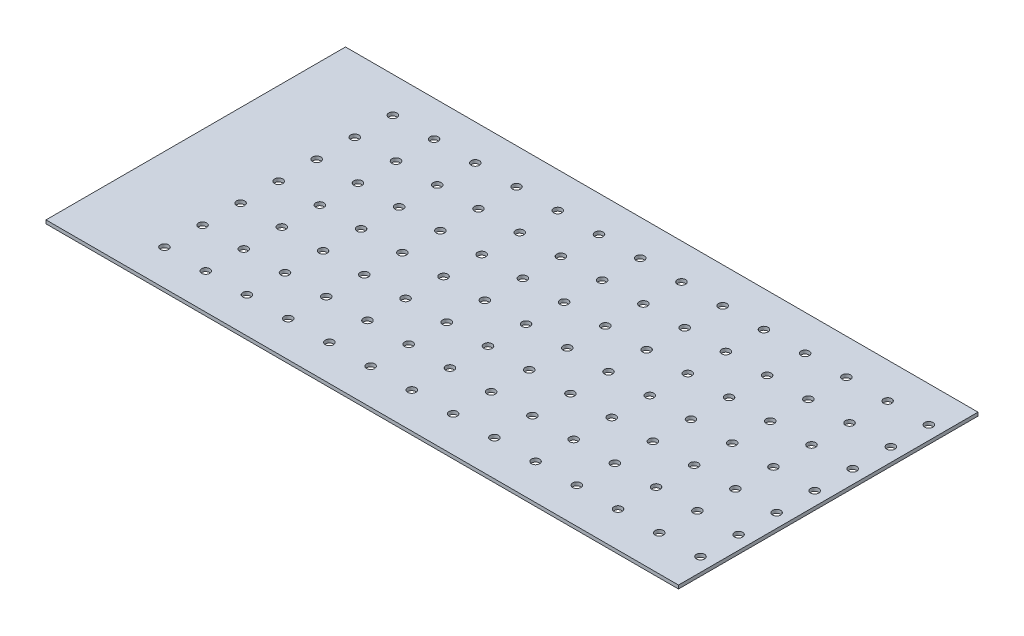
from build123d import *

# Parameters (mm, degrees)
SKETCH1_W            = 540
SKETCH1_H            = 258.64
BOSS_EXTRUDE1_DEPTH  = 3.18
CUT_EXTRUDE1_REACH   = 301.389
SKETCH2_R            = 3.75
LPATTERN1_COUNT      = 14
LPATTERN1_PITCH      = 37.81
LPATTERN1_COUNT_DIR2 = 7
LPATTERN1_PITCH_DIR2 = 34.9
SKETCH4_W            = 258.64
SKETCH4_H            = 3.18
BOSS_EXTRUDE2_DEPTH  = 40
SKETCH5_W            = 580
SKETCH5_H            = 3.18
BOSS_EXTRUDE3_DEPTH  = 8


with BuildPart() as part:
    # Sketch1 → Boss-Extrude1 (new body)
    with BuildSketch(Plane(origin=(0, 0, 0), x_dir=(1, 0, 0), z_dir=(0, 1, 0))):
        Rectangle(SKETCH1_W, SKETCH1_H)
    extrude(amount=BOSS_EXTRUDE1_DEPTH)

    # Sketch2 → Cut-Extrude1 (cut, up to next)
    with BuildSketch(Plane(origin=(0, 3.18, 0), x_dir=(1, 0, 0), z_dir=(0, 1, 0)), mode=Mode.PRIVATE) as cut_extrude1_sk1:
        with Locations(Location((-234, 104.72, 0), (0, 0, 270))):
            Circle(SKETCH2_R)
    cut_extrude1_tool1 = extrude(cut_extrude1_sk1.sketch, amount=-CUT_EXTRUDE1_REACH, mode=Mode.PRIVATE) & part.part
    cut_extrude1 = cut_extrude1_tool1.solids().sort_by_distance((-234, 3.18, -104.72))[0]
    add(cut_extrude1, mode=Mode.SUBTRACT)

    # LPattern1: Cut-Extrude1 14 × 7
    with Locations(*[(i * LPATTERN1_PITCH, 0, j * LPATTERN1_PITCH_DIR2) for i in range(LPATTERN1_COUNT) for j in range(LPATTERN1_COUNT_DIR2) if (i, j) != (0, 0)]):
        add(cut_extrude1, mode=Mode.SUBTRACT)

    # Sketch4 → Boss-Extrude2 (add)
    with BuildSketch(Plane.ZY.offset(270)):
        with Locations((0, 1.59)):
            Rectangle(SKETCH4_W, SKETCH4_H)
    extrude(amount=BOSS_EXTRUDE2_DEPTH)

    # Sketch5 → Boss-Extrude3 (add)
    with BuildSketch(Plane.XY.offset(129.32)):
        with Locations((-20, 1.59)):
            Rectangle(SKETCH5_W, SKETCH5_H)
    boss_extrude3 = extrude(amount=BOSS_EXTRUDE3_DEPTH)

    # Mirror1: Boss-Extrude3 across plane
    add(boss_extrude3.mirror(Plane.XY))


solid = part.part
